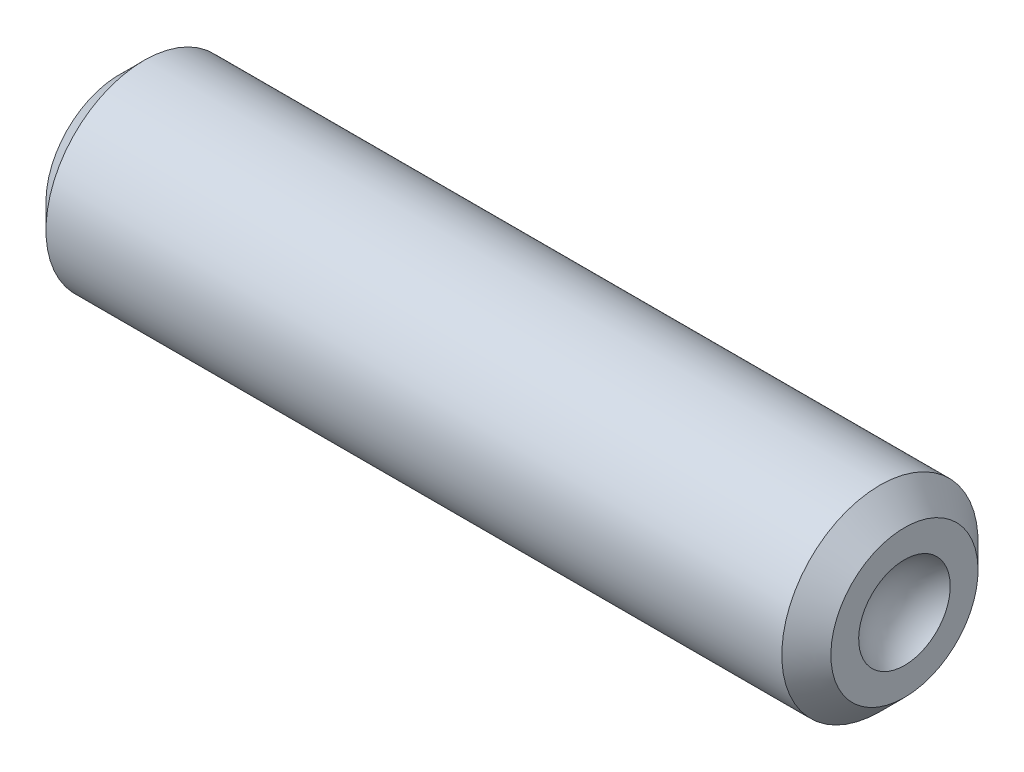
from build123d import *

# Parameters (mm, degrees)
CUT_EXTRUDE1_DEPTH = 10


with BuildPart() as part:
    # Sketch1 → Revolve1 (revolve)
    with BuildSketch(Plane.XY, mode=Mode.PRIVATE) as revolve1_sk:
        with BuildLine():
            Line((0, 0), (0, 1.125))
            Line((0, 1.125), (0.375, 1.5))
            Line((0.375, 1.5), (11.625, 1.5))
            Line((11.625, 1.5), (12, 1.125))
            Line((12, 1.125), (12, 0.7))
            ThreePointArc((12, 0.7), (11.724655592, 0.397059504), (11.625, 0))
            Line((11.625, 0), (0, 0))
        make_face()
    revolve(revolve1_sk.sketch.rotate(Axis((0, 0, 0), (1, 0, 0)), 180), axis=Axis((0, 0, 0), (1, 0, 0)))

    # Sketch2 → Cut-Extrude1 (cut)
    with BuildSketch(Plane.ZY):
        Polygon((0, 0.866025404), (-0.75, 0.433012702), (-0.75, -0.433012702), (0, -0.866025404), (0.75, -0.433012702), (0.75, 0.433012702), align=None)
    extrude(amount=-CUT_EXTRUDE1_DEPTH, mode=Mode.SUBTRACT)


solid = part.part
